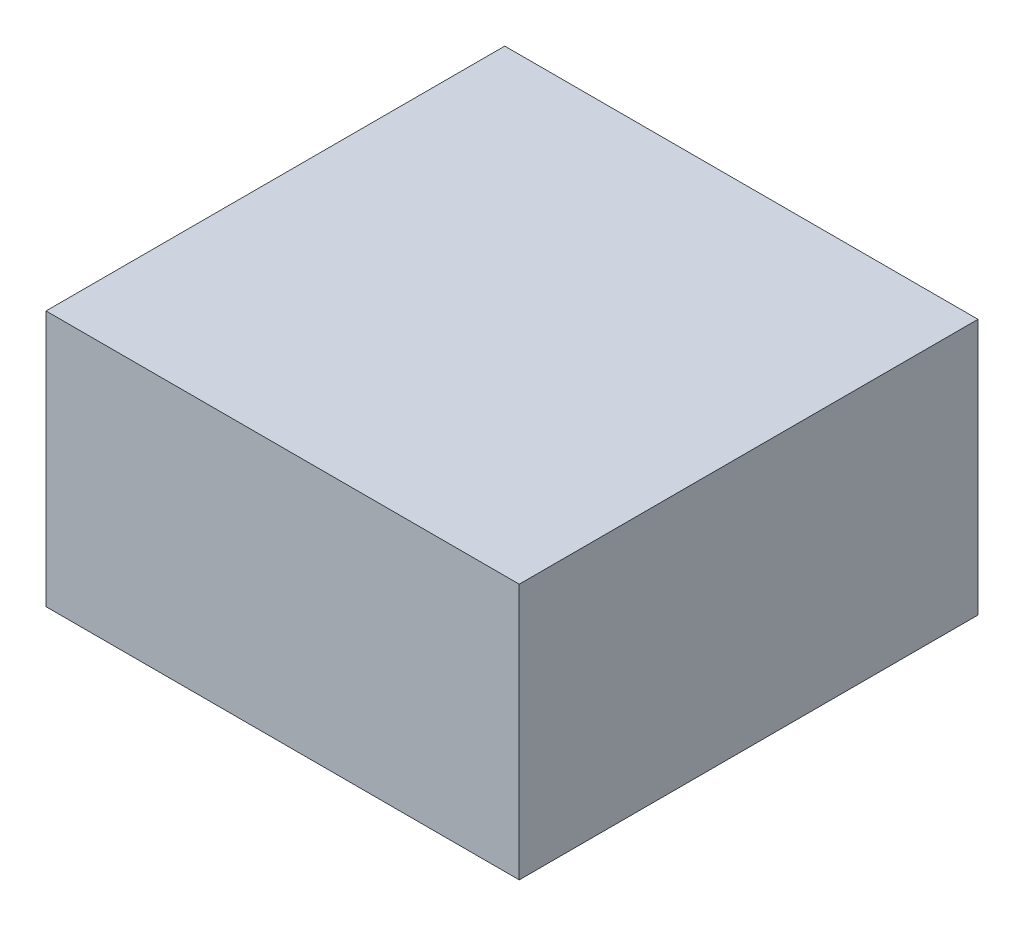
from build123d import *

# Parameters (mm, degrees)
SKETCH1_W           = 18.476967763
SKETCH1_H           = 17.91137931
BOSS_EXTRUDE1_DEPTH = 10


with BuildPart() as part:
    # Sketch1 → Boss-Extrude1 (new body)
    with BuildSketch(Plane(origin=(0, 0, 0), x_dir=(1, 0, 0), z_dir=(0, 1, 0))):
        with Locations((9.238483882, 8.955689655)):
            Rectangle(SKETCH1_W, SKETCH1_H)
    extrude(amount=BOSS_EXTRUDE1_DEPTH)


solid = part.part
